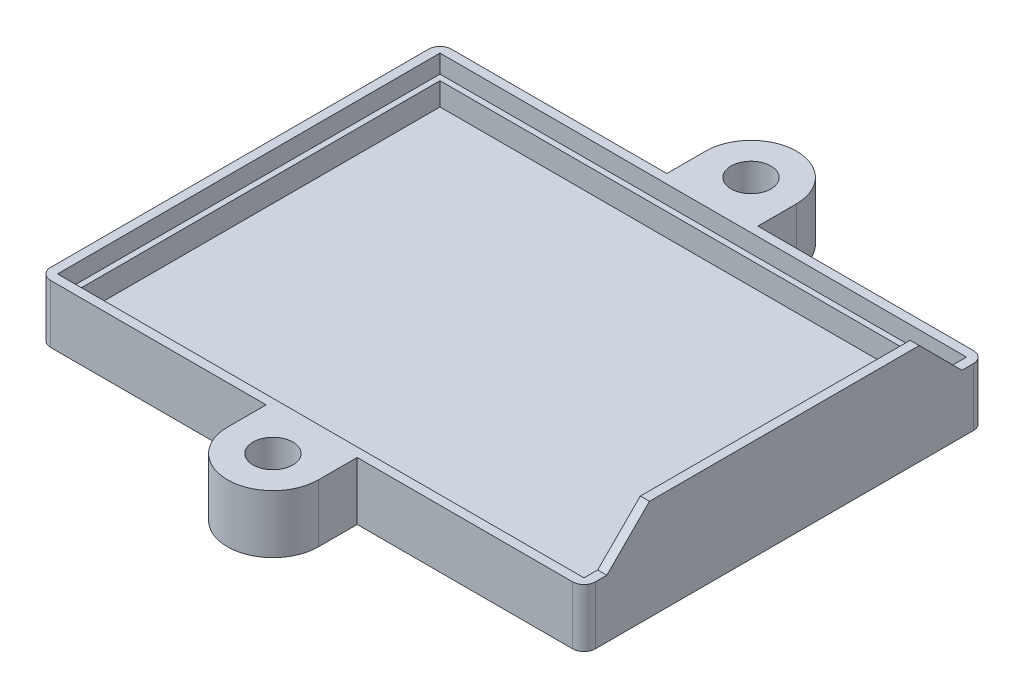
from build123d import *

# Parameters (mm, degrees)
SKETCH1_W           = 47.85
SKETCH1_H           = 35.2
BOSS_EXTRUDE1_DEPTH = 5.1
SKETCH2_W           = 46.25
SKETCH2_H           = 33.6
CUT_EXTRUDE1_DEPTH  = 1.6
SKETCH3_W           = 45.25
SKETCH3_H           = 32.6
CUT_EXTRUDE2_DEPTH  = 2
BOSS_EXTRUDE2_DEPTH = 0.8
FILLET1_R           = 1
SKETCH6_R           = 1.75
BOSS_EXTRUDE3_DEPTH = 5.1


with BuildPart() as part:
    # Sketch1 → Boss-Extrude1 (new body)
    with BuildSketch(Plane(origin=(0, 0, 0), x_dir=(1, 0, 0), z_dir=(0, 1, 0))):
        Rectangle(SKETCH1_W, SKETCH1_H)
    extrude(amount=BOSS_EXTRUDE1_DEPTH)

    # Sketch2 → Cut-Extrude1 (cut)
    with BuildSketch(Plane(origin=(0, 5.1, 0), x_dir=(1, 0, 0), z_dir=(0, 1, 0))):
        Rectangle(SKETCH2_W, SKETCH2_H)
    extrude(amount=-CUT_EXTRUDE1_DEPTH, mode=Mode.SUBTRACT)

    # Sketch3 → Cut-Extrude2 (cut)
    with BuildSketch(Plane(origin=(0, 3.5, 0), x_dir=(1, 0, 0), z_dir=(0, 1, 0))):
        Rectangle(SKETCH3_W, SKETCH3_H)
    extrude(amount=-CUT_EXTRUDE2_DEPTH, mode=Mode.SUBTRACT)

    # Sketch4 → Boss-Extrude2 (add)
    with BuildSketch(Plane(origin=(23.925, 0, 0), x_dir=(0, 0, -1), z_dir=(1, 0, 0))):
        Polygon((-15.6, 5.1), (-11.85, 8.85), (11.85, 8.85), (15.6, 5.1), align=None)
    extrude(amount=-BOSS_EXTRUDE2_DEPTH)

    # Fillet1
    fillet1_edges = [part.edges().sort_by_distance(p)[0] for p in [
        (-23.925, 2.55, -17.6),
        (23.925, 2.55, -17.6),
        (23.925, 2.55, 17.6),
        (-23.925, 2.55, 17.6),
    ]]
    fillet(fillet1_edges, radius=FILLET1_R)

    # Sketch6 → Boss-Extrude3 (add)
    # profile 1 of 2: a face of its own
    with BuildSketch(Plane.XZ):
        with BuildLine():
            Line((-4, 17.6), (4, 17.6))
            Line((4, 17.6), (4, 21))
            ThreePointArc((4, 21), (0, 25), (-4, 21))
            Line((-4, 21), (-4, 17.6))
        make_face()
        with Locations(Location((0, 21, 0), (0, 0, 270))):
            Circle(SKETCH6_R, mode=Mode.SUBTRACT)
    # profile 2 of 2: a face of its own
    with BuildSketch(Plane.XZ):
        with BuildLine():
            Line((-4, -17.6), (-4, -21))
            ThreePointArc((-4, -21), (0, -25), (4, -21))
            Line((4, -21), (4, -17.6))
            Line((4, -17.6), (-4, -17.6))
        make_face()
        with Locations(Location((0, -21, 0), (0, 0, 270))):
            Circle(SKETCH6_R, mode=Mode.SUBTRACT)
    extrude(amount=-BOSS_EXTRUDE3_DEPTH)


solid = part.part
